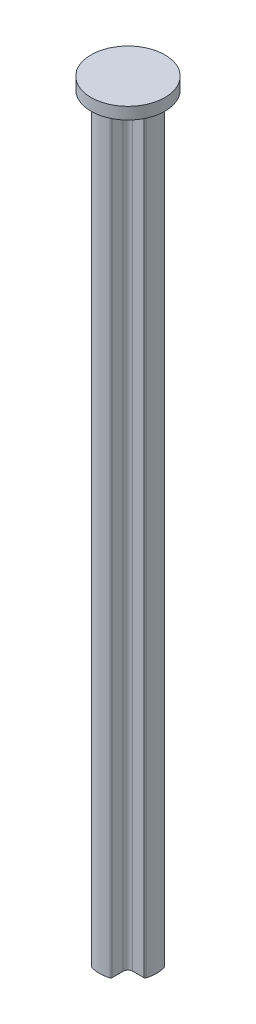
from build123d import *

# Parameters (mm, degrees)
SKETCH1_R           = 3.1
BOSS_EXTRUDE1_DEPTH = 64
SKETCH2_R           = 3.1
CUT_EXTRUDE1_DEPTH  = 63


with BuildPart() as part:
    # Sketch1 → Boss-Extrude1 (new body)
    with BuildSketch(Plane(origin=(0, 0, 0), x_dir=(1, 0, 0), z_dir=(0, 1, 0))):
        with Locations(Location((0, 0, 0), (0, 0, 270))):
            Circle(SKETCH1_R)
    extrude(amount=BOSS_EXTRUDE1_DEPTH)

    # Sketch2 → Cut-Extrude1 (cut)
    with BuildSketch(Plane(origin=(0, 0, 0), x_dir=(1, 0, 0), z_dir=(0, 1, 0))):
        with Locations(Location((0, 0, 0), (0, 0, 270))):
            Circle(SKETCH2_R)
        with BuildLine():
            Line((1.24, -0.84), (2.177705214, -0.84))
            ThreePointArc((2.177705214, -0.84), (2.235940121, -0.821293884), (2.27238805, -0.772173913))
            ThreePointArc((2.27238805, -0.772173913), (2.4, 0), (2.27238805, 0.772173913))
            ThreePointArc((2.27238805, 0.772173913), (2.235940121, 0.821293884), (2.177705214, 0.84))
            Line((2.177705214, 0.84), (1.24, 0.84))
            ThreePointArc((1.24, 0.84), (0.957157288, 0.957157288), (0.84, 1.24))
            Line((0.84, 1.24), (0.84, 2.177705214))
            ThreePointArc((0.84, 2.177705214), (0.821293884, 2.235940121), (0.772173913, 2.27238805))
            ThreePointArc((0.772173913, 2.27238805), (0, 2.4), (-0.772173913, 2.27238805))
            ThreePointArc((-0.772173913, 2.27238805), (-0.821293884, 2.235940121), (-0.84, 2.177705214))
            Line((-0.84, 2.177705214), (-0.84, 1.24))
            ThreePointArc((-0.84, 1.24), (-0.957157288, 0.957157288), (-1.24, 0.84))
            Line((-1.24, 0.84), (-2.177705214, 0.84))
            ThreePointArc((-2.177705214, 0.84), (-2.235940121, 0.821293884), (-2.27238805, 0.772173913))
            ThreePointArc((-2.27238805, 0.772173913), (-2.4, 0), (-2.27238805, -0.772173913))
            ThreePointArc((-2.27238805, -0.772173913), (-2.235940121, -0.821293884), (-2.177705214, -0.84))
            Line((-2.177705214, -0.84), (-1.24, -0.84))
            ThreePointArc((-1.24, -0.84), (-0.957157288, -0.957157288), (-0.84, -1.24))
            Line((-0.84, -1.24), (-0.84, -2.177705214))
            ThreePointArc((-0.84, -2.177705214), (-0.821293884, -2.235940121), (-0.772173913, -2.27238805))
            ThreePointArc((-0.772173913, -2.27238805), (0, -2.4), (0.772173913, -2.27238805))
            ThreePointArc((0.772173913, -2.27238805), (0.821293884, -2.235940121), (0.84, -2.177705214))
            Line((0.84, -2.177705214), (0.84, -1.24))
            ThreePointArc((0.84, -1.24), (0.957157288, -0.957157288), (1.24, -0.84))
        make_face(mode=Mode.SUBTRACT)
    extrude(amount=CUT_EXTRUDE1_DEPTH, mode=Mode.SUBTRACT)


solid = part.part
